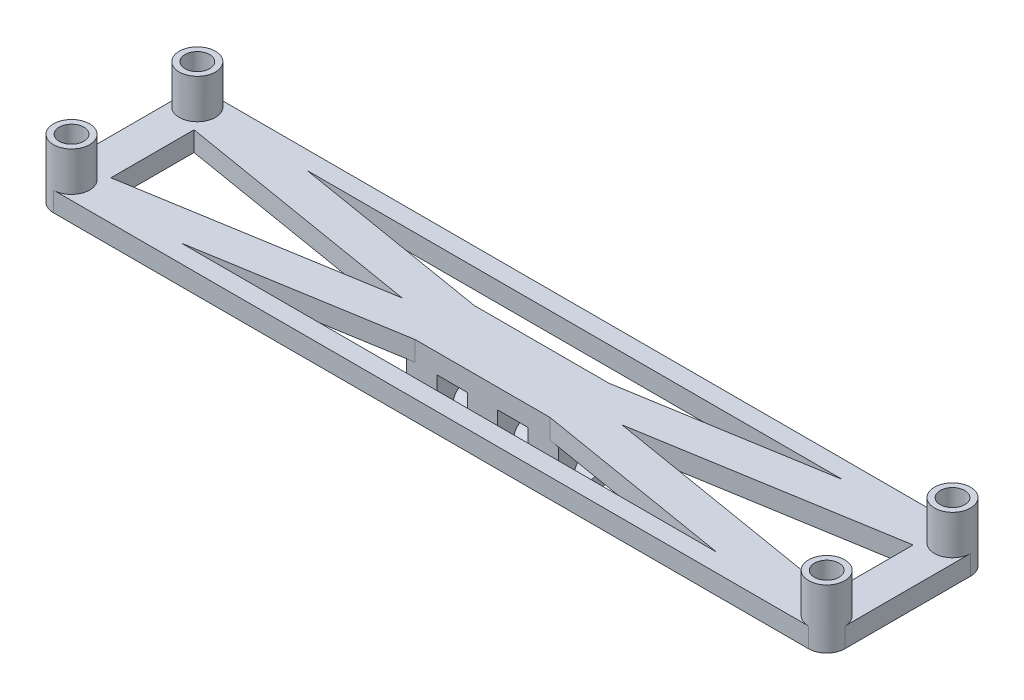
from build123d import *

# Parameters (mm, degrees)
BOSS_EXTRUDE2_DEPTH = 2
SKETCH4_R           = 1.835
BOSS_EXTRUDE3_DEPTH = 4
SKETCH6_R           = 1.25
CUT_EXTRUDE1_DEPTH  = 4
SKETCH7_R           = 1.375
BOSS_EXTRUDE4_DEPTH = 3.086
LPATTERN1_COUNT     = 3
LPATTERN1_PITCH     = 6.172


with BuildPart() as part:
    # Sketch3 → Boss-Extrude2 (new body)
    with BuildSketch(Plane(origin=(0, 0, 0), x_dir=(1, 0, 0), z_dir=(0, 1, 0))):
        with BuildLine():
            Line((38.36, -8.225), (-38.36, -8.225))
            ThreePointArc((-38.36, -8.225), (-39.657541, -7.687541), (-40.195, -6.39))
            Line((-40.195, -6.39), (-40.195, 6.39))
            ThreePointArc((-40.195, 6.39), (-39.657541, 7.687541), (-38.36, 8.225))
            Line((-38.36, 8.225), (38.36, 8.225))
            ThreePointArc((38.36, 8.225), (39.657541, 7.687541), (40.195, 6.39))
            Line((40.195, 6.39), (40.195, -6.39))
            ThreePointArc((40.195, -6.39), (39.657541, -7.687541), (38.36, -8.225))
        make_face()
        Polygon((6.841855, -3), (27.192466, -6.39), (-27.192466, -6.39), (-6.841855, -3), align=None, mode=Mode.SUBTRACT)
        Polygon((-27.192466, 6.39), (-6.841855, 3), (6.841855, 3), (27.192466, 6.39), align=None, mode=Mode.SUBTRACT)
        Polygon((-36.525, 4.224041), (-36.525, -4.224041), (-11.167534, 0), align=None, mode=Mode.SUBTRACT)
        Polygon((36.525, -4.224041), (11.167534, 0), (36.525, 4.224041), align=None, mode=Mode.SUBTRACT)
    extrude(amount=BOSS_EXTRUDE2_DEPTH)

    # Sketch4 → Boss-Extrude3 (add)
    with BuildSketch(Plane(origin=(0, 2, 0), x_dir=(1, 0, 0), z_dir=(0, 1, 0))):
        with Locations(Location((-38.36, 6.39, 0), (0, 0, 90))):
            Circle(SKETCH4_R)
        with Locations(Location((-38.36, -6.39, 0), (0, 0, 270))):
            Circle(SKETCH4_R)
        with Locations(Location((38.36, 6.39, 0), (0, 0, 90))):
            Circle(SKETCH4_R)
        with Locations(Location((38.36, -6.39, 0), (0, 0, 270))):
            Circle(SKETCH4_R)
    extrude(amount=BOSS_EXTRUDE3_DEPTH)

    # Sketch6 → Cut-Extrude1 (cut)
    with BuildSketch(Plane(origin=(0, 6, 0), x_dir=(1, 0, 0), z_dir=(0, 1, 0))):
        with Locations(Location((-38.36, 6.39, 0), (0, 0, 270))):
            Circle(SKETCH6_R)
        with Locations(Location((-38.36, -6.39, 0), (0, 0, 270))):
            Circle(SKETCH6_R)
        with Locations(Location((38.36, 6.39, 0), (0, 0, 270))):
            Circle(SKETCH6_R)
        with Locations(Location((38.36, -6.39, 0), (0, 0, 270))):
            Circle(SKETCH6_R)
    extrude(amount=-CUT_EXTRUDE1_DEPTH, mode=Mode.SUBTRACT)

    # Sketch7 → Boss-Extrude4 (add)
    with BuildSketch(Plane.ZY.offset(-7.715)):
        with BuildLine():
            Line((-3, 0), (3, 0))
            Line((3, 0), (3, -3.4))
            ThreePointArc((3, -3.4), (0, -6.4), (-3, -3.4))
            Line((-3, -3.4), (-3, 0))
        make_face()
        with Locations((0, -3.4)):
            Circle(SKETCH7_R, mode=Mode.SUBTRACT)
    boss_extrude4 = extrude(amount=BOSS_EXTRUDE4_DEPTH)

    # LPattern1: Boss-Extrude4 ×3
    with Locations(*[(-i * LPATTERN1_PITCH, 0, 0) for i in range(1, LPATTERN1_COUNT)]):
        add(boss_extrude4)


solid = part.part
